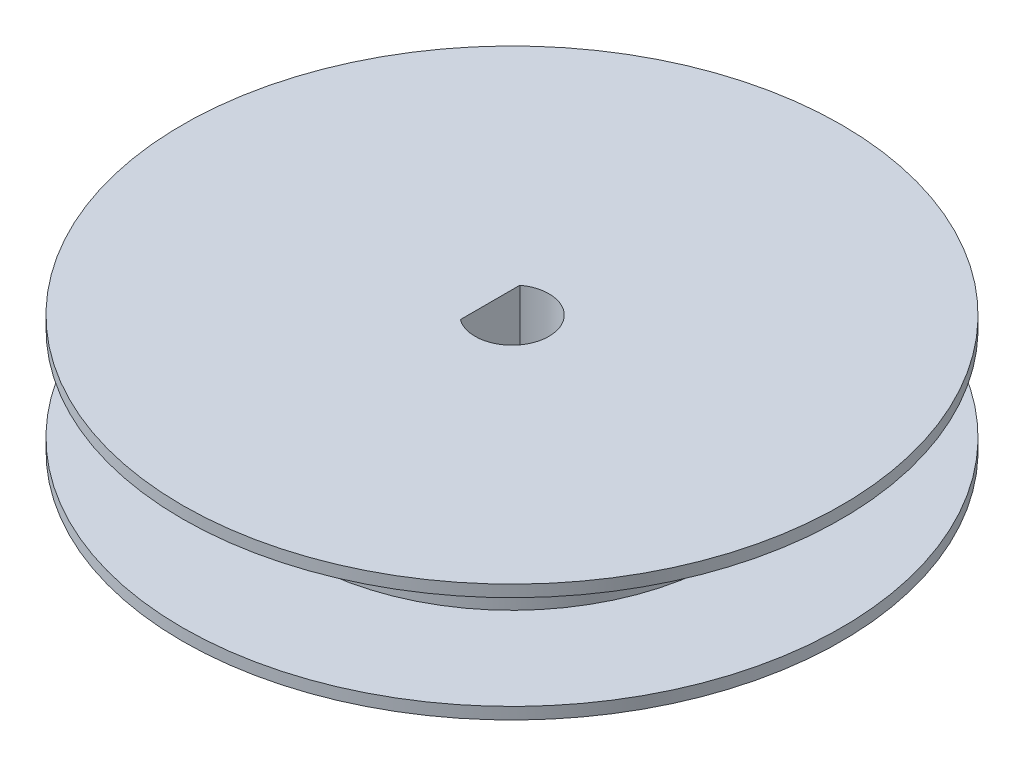
from build123d import *

# Parameters (mm, degrees)
SKETCH_1_R          = 9
EXTRUDE_1_DEPTH     = 5
CUT_EXTRUDE_1_DEPTH = 14.674794331
SKETCH_6_R          = 0.498388016
CUT_EXTRUDE_3_DEPTH = 50
EXTRUDE_START       = -0.5
SKETCH_3_R          = 14
SKETCH_3_R_2        = 9
EXTRUDE_2_DEPTH     = 0.5
SKETCH_5_R          = 14
SKETCH_5_R_2        = 9
EXTRUDE_3_DEPTH     = 0.5


with BuildPart() as part:
    # 草圖1 → 填料-伸長1 (new body)
    with BuildSketch(Plane(origin=(0, 0, 0), x_dir=(1, 0, 0), z_dir=(0, 1, 0))):
        with Locations(Location((0, 0, 0), (0, 0, 270))):
            Circle(SKETCH_1_R)
    extrude(amount=EXTRUDE_1_DEPTH)

    # 草圖2 → 除料-伸長1 (cut, through all)
    with BuildSketch(Plane(origin=(0, 5, 0), x_dir=(1, 0, 0), z_dir=(0, 1, 0))):
        with BuildLine():
            Line((-0.93, 1.264911064), (-0.93, -1.264911064))
            ThreePointArc((-0.93, -1.264911064), (0.708801806, -1.400892573), (1.57, 0))
            ThreePointArc((1.57, 0), (0.708801806, 1.400892573), (-0.93, 1.264911064))
        make_face()
    extrude(amount=-CUT_EXTRUDE_1_DEPTH, mode=Mode.SUBTRACT)

    # 草圖6 → 除料-伸長3 (cut, symmetric)
    with BuildSketch(Plane(origin=(0, 0, 0), x_dir=(0, 0, -1), z_dir=(1, 0, 0))):
        with Locations((-8.29743406, 2.581049417)):
            Circle(SKETCH_6_R)
    extrude(amount=CUT_EXTRUDE_3_DEPTH, both=True, mode=Mode.SUBTRACT)

    # 草圖3 → 填料-伸長2 (add)
    with BuildSketch(Plane(origin=(0, 5, 0), x_dir=(1, 0, 0), z_dir=(0, 1, 0)).offset(EXTRUDE_START)):
        with Locations(Location((0, 0, 0), (0, 0, 270))):
            Circle(SKETCH_3_R)
        with Locations(Location((0, 0, 0), (0, 0, 270))):
            Circle(SKETCH_3_R_2, mode=Mode.SUBTRACT)
    extrude(amount=EXTRUDE_2_DEPTH)

    # 草圖5 → 填料-伸長3 (add)
    with BuildSketch(Plane.XZ):
        with Locations(Location((0, 0, 0), (0, 0, 90))):
            Circle(SKETCH_5_R)
        with Locations(Location((0, 0, 0), (0, 0, 270))):
            Circle(SKETCH_5_R_2, mode=Mode.SUBTRACT)
    extrude(amount=-EXTRUDE_3_DEPTH)


solid = part.part
